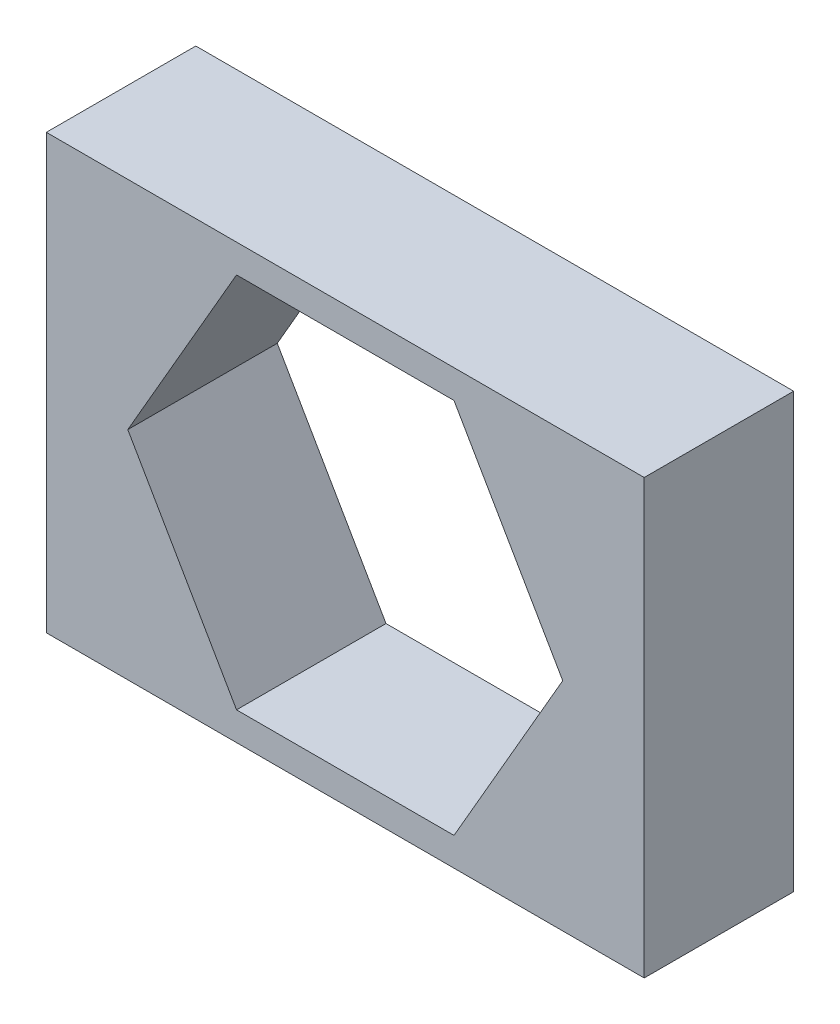
from build123d import *

# Parameters (mm, degrees)
ESQUISSE1_W        = 20
ESQUISSE1_H        = 14.5
BOSS_EXTRU_1_DEPTH = 5


with BuildPart() as part:
    # Esquisse1 → Boss.-Extru.1 (new body)
    with BuildSketch(Plane.XY):
        with Locations((10, 7.25)):
            Rectangle(ESQUISSE1_W, ESQUISSE1_H)
        Polygon((17.274613392, 7.25), (13.637306696, 13.55), (6.362693304, 13.55), (2.725386608, 7.25), (6.362693304, 0.95), (13.637306696, 0.95), align=None, mode=Mode.SUBTRACT)
    extrude(amount=BOSS_EXTRU_1_DEPTH)


solid = part.part
